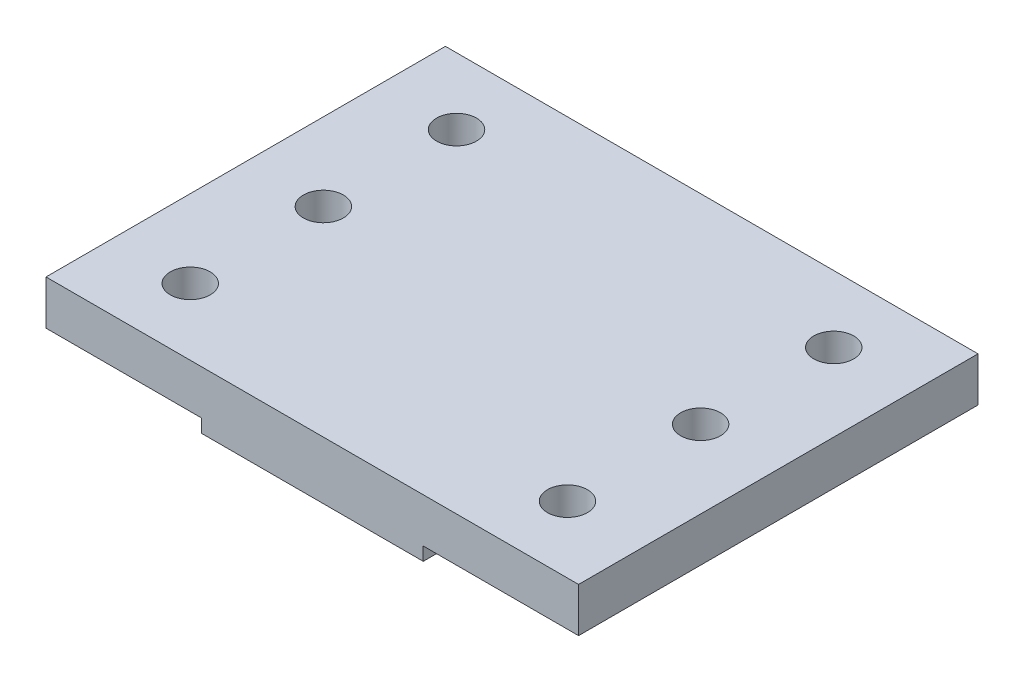
from build123d import *

# Parameters (mm, degrees)
BOSS_EXTRUDE1_DEPTH = 45
SKETCH2_R           = 2.25
CUT_EXTRUDE1_DEPTH  = 55.472470111


with BuildPart() as part:
    # Sketch1 → Boss-Extrude1 (new body)
    with BuildSketch(Plane.XY):
        Polygon((-12.5, -2.5), (-12.5, -4), (12.5, -4), (12.5, -2.5), (30, -2.5), (30, 2.5), (-30, 2.5), (-30, -2.5), align=None)
    extrude(amount=BOSS_EXTRUDE1_DEPTH)

    # Sketch2 → Cut-Extrude1 (cut, through all)
    with BuildSketch(Plane(origin=(0, 2.5, 0), x_dir=(1, 0, 0), z_dir=(0, 1, 0))):
        with Locations(Location((-21.25, -7.5, 0), (0, 0, 180))):
            Circle(SKETCH2_R)
        with Locations(Location((-21.25, -22.5, 0), (0, 0, 180))):
            Circle(SKETCH2_R)
        with Locations(Location((-21.25, -37.5, 0), (0, 0, 180))):
            Circle(SKETCH2_R)
        with Locations(Location((21.25, -37.5, 0), (0, 0, 180))):
            Circle(SKETCH2_R)
        with Locations(Location((21.25, -22.5, 0), (0, 0, 180))):
            Circle(SKETCH2_R)
        with Locations(Location((21.25, -7.5, 0), (0, 0, 180))):
            Circle(SKETCH2_R)
    extrude(amount=-CUT_EXTRUDE1_DEPTH, mode=Mode.SUBTRACT)


solid = part.part
